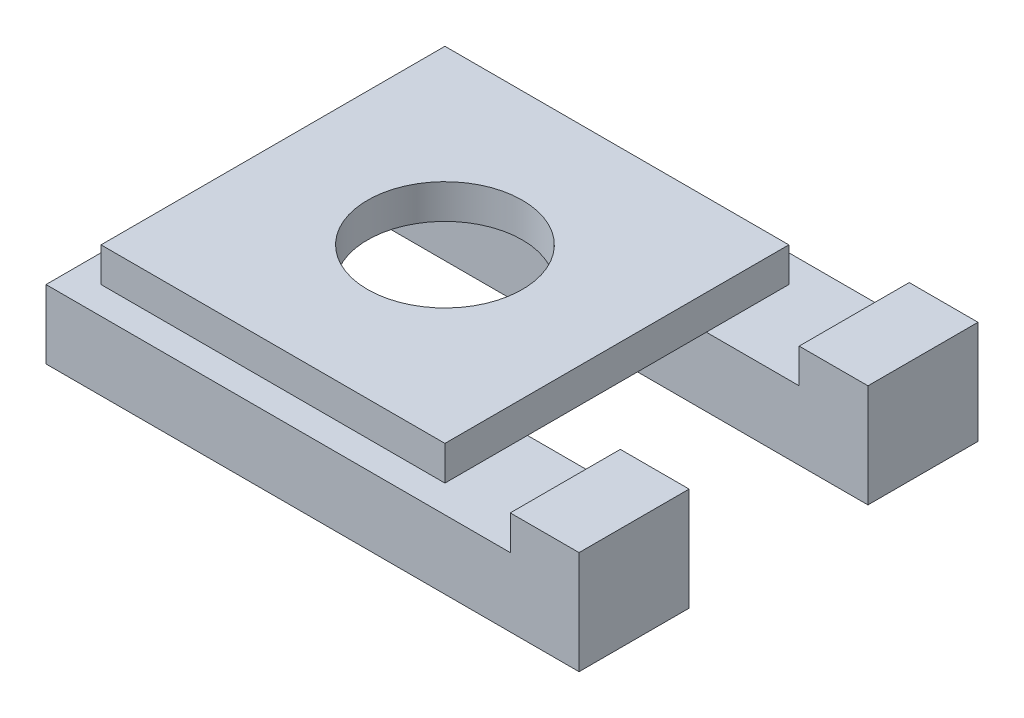
from build123d import *

# Parameters (mm, degrees)
SKETCH1_W           = 100
SKETCH1_H           = 100
SKETCH1_R           = 22.5
BOSS_EXTRUDE1_DEPTH = 10
SKETCH2_W           = 155
SKETCH2_H           = 32
BOSS_EXTRUDE4_DEPTH = 20
SKETCH2_5_W         = 20
SKETCH2_5_H         = 32
BOSS_EXTRUDE5_DEPTH = 10


with BuildPart() as part:
    # Sketch1 → Boss-Extrude1 (new body)
    with BuildSketch(Plane(origin=(0, 0, 0), x_dir=(1, 0, 0), z_dir=(0, 1, 0))):
        Rectangle(SKETCH1_W, SKETCH1_H)
        Circle(SKETCH1_R, mode=Mode.SUBTRACT)
    extrude(amount=BOSS_EXTRUDE1_DEPTH)

    # Sketch2 → Boss-Extrude4 (add)
    with BuildSketch(Plane.XZ):
        with Locations((19.5, 42)):
            Rectangle(SKETCH2_W, SKETCH2_H)
        with Locations((19.5, -42)):
            Rectangle(SKETCH2_W, SKETCH2_H)
    extrude(amount=BOSS_EXTRUDE4_DEPTH)

    # Sketch2<5> → Boss-Extrude5 (add)
    with BuildSketch(Plane.XZ):
        with Locations((87, 42)):
            Rectangle(SKETCH2_5_W, SKETCH2_5_H)
        with Locations((87, -42)):
            Rectangle(SKETCH2_5_W, SKETCH2_5_H)
    extrude(amount=-BOSS_EXTRUDE5_DEPTH)


solid = part.part
